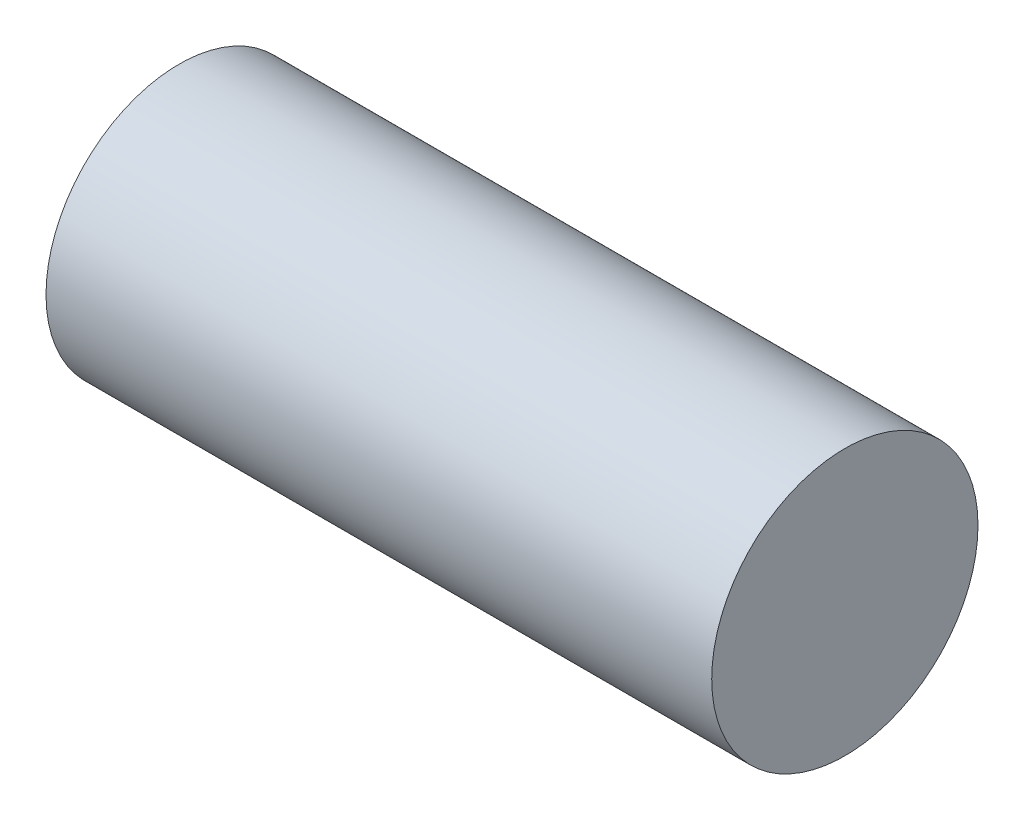
from build123d import *

# Parameters (mm, degrees)
AXIAL_BLANK_PROFILE_W = 20
AXIAL_BLANK_PROFILE_H = 4


with BuildPart() as part:
    # Axial blank profile → Native revolved blank (revolve)
    with BuildSketch(Plane.XY, mode=Mode.PRIVATE) as native_revolved_blank_sk:
        with Locations((-7, 2)):
            Rectangle(AXIAL_BLANK_PROFILE_W, AXIAL_BLANK_PROFILE_H)
    revolve(native_revolved_blank_sk.sketch.rotate(Axis((-60, 0, 0), (1, 0, 0)), 90), axis=Axis((-60, 0, 0), (1, 0, 0)))


solid = part.part
